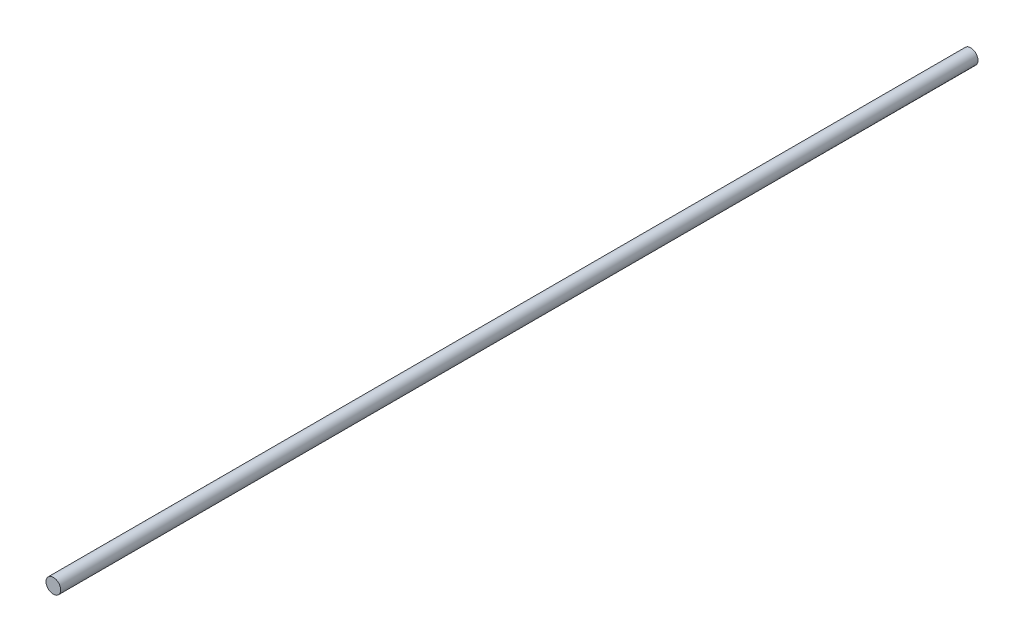
from build123d import *

# Parameters (mm, degrees)
SKETCH1_R           = 0.4064
BOSS_EXTRUDE1_DEPTH = 50.8


with BuildPart() as part:
    # Sketch1 → Boss-Extrude1 (new body)
    with BuildSketch(Plane.XY):
        Circle(SKETCH1_R)
    extrude(amount=-BOSS_EXTRUDE1_DEPTH)


solid = part.part
